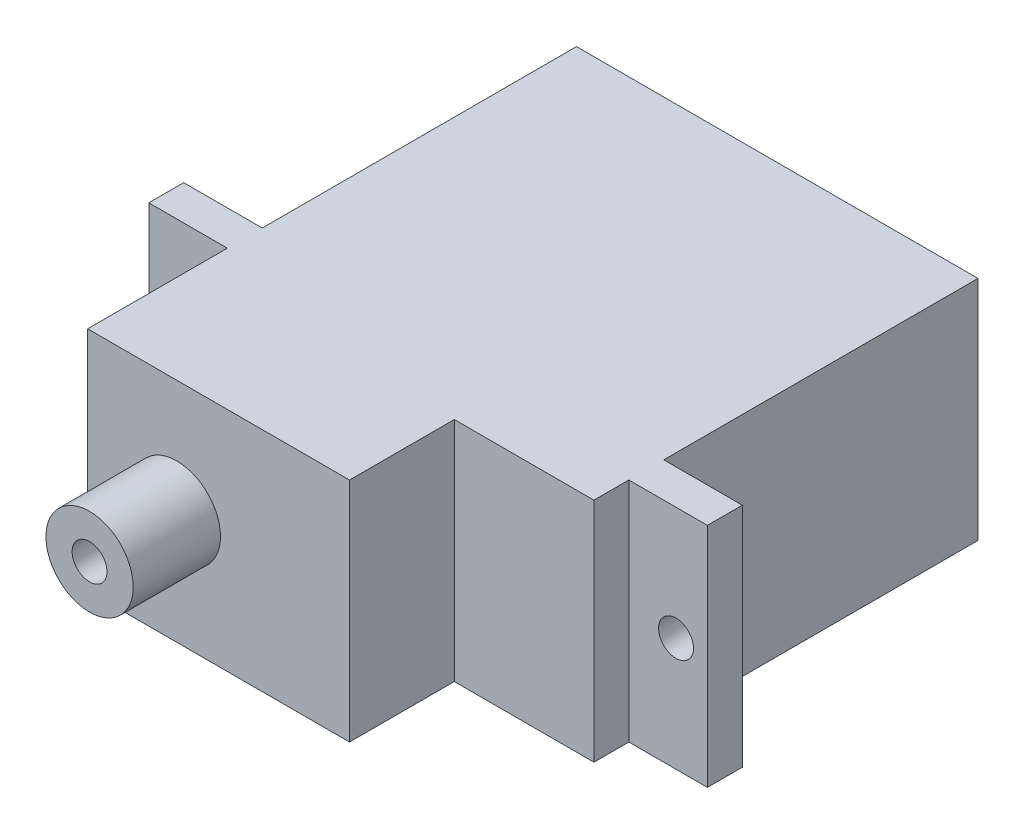
from build123d import *

# Parameters (mm, degrees)
SKETCH1_W           = 23
SKETCH1_H           = 13
BOSS_EXTRUDE1_DEPTH = 18
SKETCH2_W           = 32
SKETCH2_H           = 13
BOSS_EXTRUDE2_DEPTH = 2
SKETCH3_W           = 23
SKETCH3_H           = 13
BOSS_EXTRUDE3_DEPTH = 2
SKETCH4_W           = 15
SKETCH4_H           = 13
BOSS_EXTRUDE4_DEPTH = 6
SKETCH5_R           = 2.5
BOSS_EXTRUDE5_DEPTH = 5
SKETCH6_R           = 1
CUT_EXTRUDE1_DEPTH  = 5
SKETCH7_R           = 1
CUT_EXTRUDE2_DEPTH  = 5


with BuildPart() as part:
    # Sketch1 → Boss-Extrude1 (new body)
    with BuildSketch(Plane.XY):
        Rectangle(SKETCH1_W, SKETCH1_H)
    extrude(amount=BOSS_EXTRUDE1_DEPTH)

    # Sketch2 → Boss-Extrude2 (add)
    with BuildSketch(Plane.XY.offset(18)):
        Rectangle(SKETCH2_W, SKETCH2_H)
    extrude(amount=BOSS_EXTRUDE2_DEPTH)

    # Sketch3 → Boss-Extrude3 (add)
    with BuildSketch(Plane.XY.offset(20)):
        Rectangle(SKETCH3_W, SKETCH3_H)
    extrude(amount=BOSS_EXTRUDE3_DEPTH)

    # Sketch4 → Boss-Extrude4 (add)
    with BuildSketch(Plane.XY.offset(22)):
        with Locations((-4, 0)):
            Rectangle(SKETCH4_W, SKETCH4_H)
    extrude(amount=BOSS_EXTRUDE4_DEPTH)

    # Sketch5 → Boss-Extrude5 (add)
    with BuildSketch(Plane.XY.offset(28)):
        with Locations((-6.391509612, 0)):
            Circle(SKETCH5_R)
    extrude(amount=BOSS_EXTRUDE5_DEPTH)

    # Sketch6 → Cut-Extrude1 (cut)
    with BuildSketch(Plane.XY.offset(33)):
        with Locations((-6.391509612, 0)):
            Circle(SKETCH6_R)
    extrude(amount=-CUT_EXTRUDE1_DEPTH, mode=Mode.SUBTRACT)

    # Sketch7 → Cut-Extrude2 (cut)
    with BuildSketch(Plane.XY.offset(20)):
        with Locations((-13.689061623, 0)):
            Circle(SKETCH7_R)
        with Locations((14.201879184, 0)):
            Circle(SKETCH7_R)
    extrude(amount=-CUT_EXTRUDE2_DEPTH, mode=Mode.SUBTRACT)


solid = part.part
